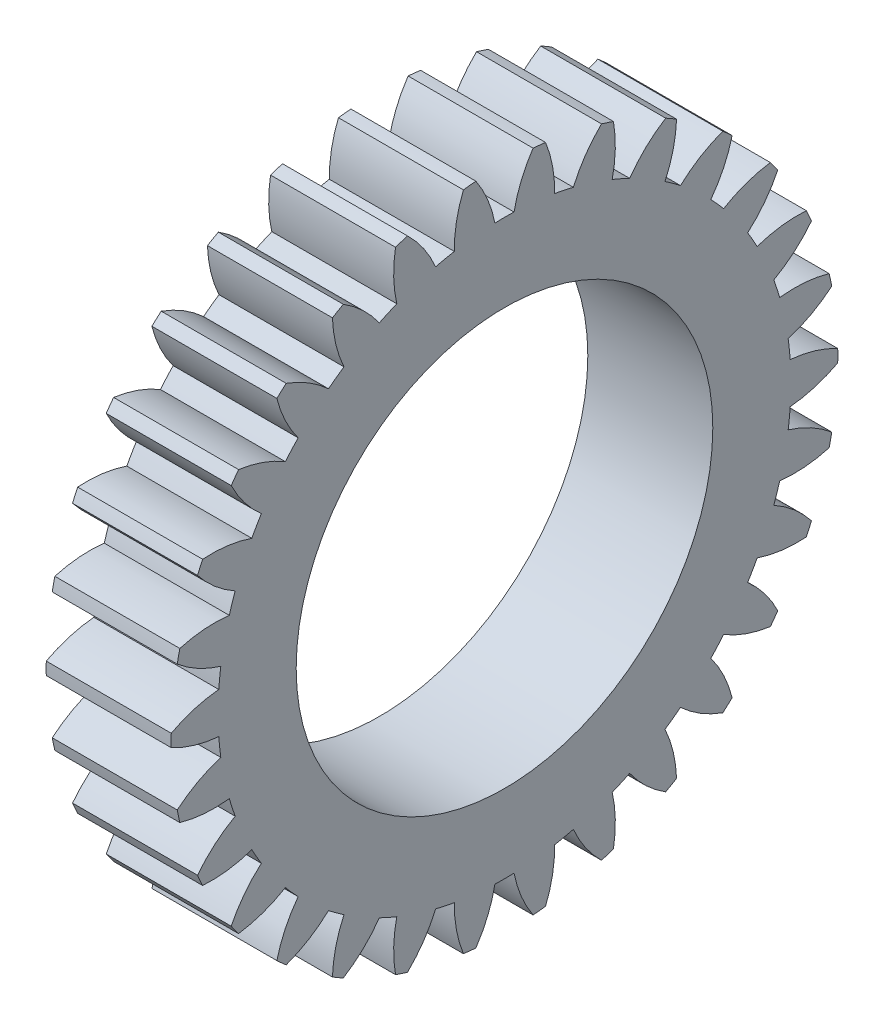
from build123d import *

# Parameters (mm, degrees)
BASPROSKE_W     = 12
BASPROSKE_H     = 32
TOOTHCUT_DEPTH  = 47.818799643
TEETHCUTS_COUNT = 30
TEETHCUTS_ANGLE = 348
BORSKE_R        = 20
BORE_DEPTH      = 50.0000508


with BuildPart() as part:
    # BasProSke → Base-Revolve (revolve)
    with BuildSketch(Plane(origin=(0, 0, 0), x_dir=(1, 0, 0), z_dir=(0, 1, 0)), mode=Mode.PRIVATE) as base_revolve_sk:
        with Locations((6, 16)):
            Rectangle(BASPROSKE_W, BASPROSKE_H)
    revolve(base_revolve_sk.sketch.rotate(Axis((-10, 0, 0), (1, 0, 0)), 180), axis=Axis((-10, 0, 0), (1, 0, 0)))

    # TooCutSke → ToothCut (cut, through all)
    with BuildSketch(Plane(origin=(0, 0, 0), x_dir=(0, 0, -1), z_dir=(1, 0, 0))):
        with BuildLine():
            ThreePointArc((0.918551563, 27.483654488), (0, 27.499), (-0.918551563, 27.483654488))
            ThreePointArc((-0.918551563, 27.483654488), (-1.617208176, 29.787801627), (-2.761784709, 31.906093311))
            ThreePointArc((-2.761784709, 31.906093311), (0, 32.0254), (2.761784709, 31.906093311))
            ThreePointArc((2.761784709, 31.906093311), (1.617208176, 29.787801627), (0.918551563, 27.483654488))
        make_face()
    toothcut = extrude(amount=TOOTHCUT_DEPTH, mode=Mode.SUBTRACT)

    # TeethCuts: ToothCut ×30 about axis
    teethcuts_axis = Axis((-10, 0, 0), (1, 0, 0))
    for i in range(1, TEETHCUTS_COUNT):
        add(toothcut.rotate(teethcuts_axis, i * TEETHCUTS_ANGLE / (TEETHCUTS_COUNT - 1)), mode=Mode.SUBTRACT)

    # BorSke → Bore (cut, symmetric)
    with BuildSketch(Plane(origin=(0, 0, 0), x_dir=(0, 0, -1), z_dir=(1, 0, 0))):
        with Locations(Location((0, 0, 0), (0, 0, 180))):
            Circle(BORSKE_R)
    extrude(amount=BORE_DEPTH, both=True, mode=Mode.SUBTRACT)


solid = part.part
